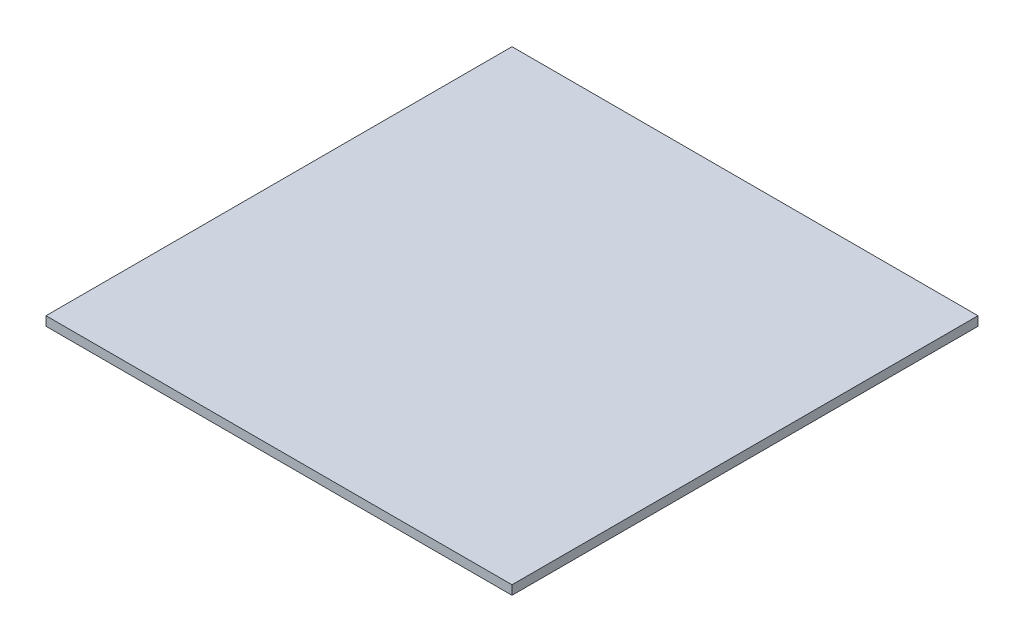
from build123d import *

# Parameters (mm, degrees)
SKETCH1_W           = 304.8
SKETCH1_H           = 304.8
BOSS_EXTRUDE1_DEPTH = 5.9944


with BuildPart() as part:
    # Sketch1 → Boss-Extrude1 (new body)
    with BuildSketch(Plane(origin=(0, 0, 0), x_dir=(1, 0, 0), z_dir=(0, 1, 0))):
        Rectangle(SKETCH1_W, SKETCH1_H)
    extrude(amount=BOSS_EXTRUDE1_DEPTH)


solid = part.part
